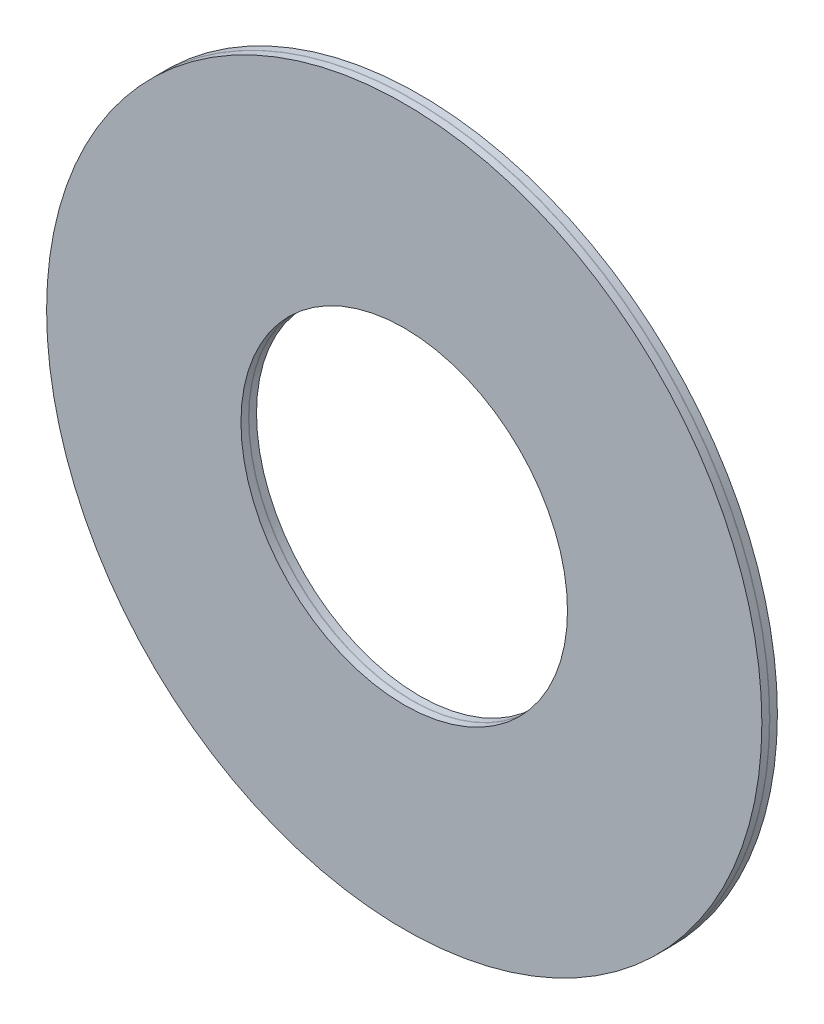
from build123d import *

# Parameters (mm, degrees)
SKETCH3_W = 0.0508
SKETCH3_H = 19.84375
SKETCH4_W = 0.76835
SKETCH4_H = 19.84375


with BuildPart() as part:
    # Sketch3 → Revolve1 (revolve)
    with BuildSketch(Plane(origin=(0, 0, 0), x_dir=(0, 0, -1), z_dir=(1, 0, 0)), mode=Mode.PRIVATE) as revolve1_sk:
        with Locations((0, 26.590625)):
            Rectangle(SKETCH3_W, SKETCH3_H)
    revolve(revolve1_sk.sketch.rotate(Axis((0, 0, -0.79375), (0, 0, 1)), 90), axis=Axis((0, 0, -0.79375), (0, 0, 1)))


with BuildPart() as body_2:
    # Sketch4 → Revolve2 (revolve)
    with BuildSketch(Plane(origin=(0, 0, 0), x_dir=(0, 0, -1), z_dir=(1, 0, 0)), mode=Mode.PRIVATE) as revolve2_sk:
        with Locations((-0.409575, 26.590625)):
            Rectangle(SKETCH4_W, SKETCH4_H)
        with Locations((0.409575, 26.590625)):
            Rectangle(SKETCH4_W, SKETCH4_H)
    revolve(revolve2_sk.sketch.rotate(Axis((0, 0, -0.79375), (0, 0, 1)), 90), axis=Axis((0, 0, -0.79375), (0, 0, 1)))


solid = Compound([part.part, body_2.part])
